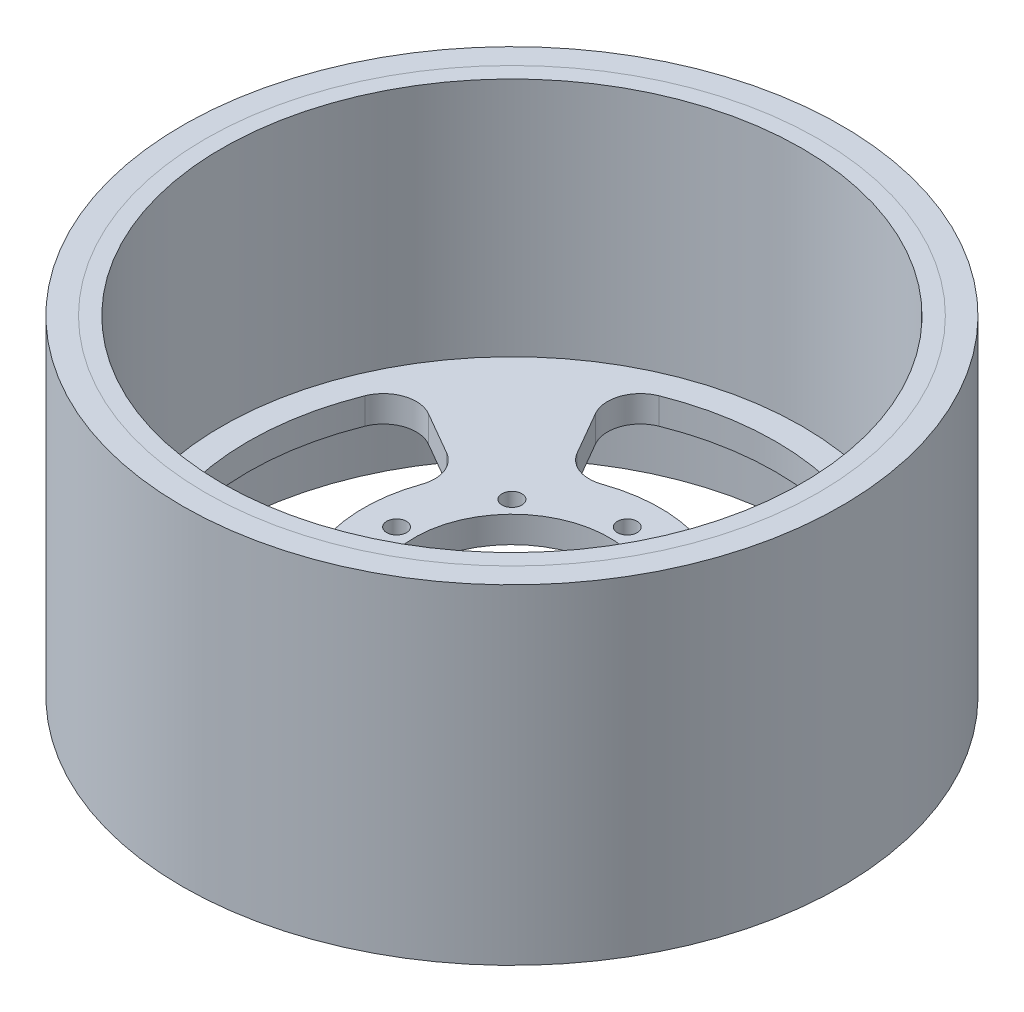
from build123d import *

# Parameters (mm, degrees)
SKETCH_1_R          = 50
EXTRUDE_1_DEPTH     = 50
SKETCH_2_R          = 44
CUT_EXTRUDE_1_DEPTH = 36.5
CUT_EXTRUDE_START   = -9.5
SKETCH_3_R          = 44
CUT_EXTRUDE_2_DEPTH = 9.5
SKETCH_4_R          = 14.75
SKETCH_4_R_2        = 1.5
CUT_EXTRUDE_3_DEPTH = 4
CUT_EXTRUDE_4_DEPTH = 4
FILLET_1_R          = 5


with BuildPart() as part:
    # 草图1 → 凸台-拉伸1 (new body)
    with BuildSketch(Plane(origin=(0, 0, 0), x_dir=(1, 0, 0), z_dir=(0, 1, 0))):
        with Locations(Location((0, 0, 0), (0, 0, 270))):
            Circle(SKETCH_1_R)
    extrude(amount=EXTRUDE_1_DEPTH)

    # 草图2 → 切除-拉伸1 (cut)
    with BuildSketch(Plane(origin=(0, 50, 0), x_dir=(1, 0, 0), z_dir=(0, 1, 0))):
        with Locations(Location((0, 0, 0), (0, 0, 270))):
            Circle(SKETCH_2_R)
    extrude(amount=-CUT_EXTRUDE_1_DEPTH, mode=Mode.SUBTRACT)

    # 草图3 → 切除-拉伸2 (cut)
    with BuildSketch(Plane.XZ.offset(CUT_EXTRUDE_START)):
        with Locations(Location((0, 0, 0), (0, 0, 90))):
            Circle(SKETCH_3_R)
    extrude(amount=CUT_EXTRUDE_2_DEPTH, mode=Mode.SUBTRACT)

    # 草图4 → 切除-拉伸3 (cut)
    with BuildSketch(Plane(origin=(0, 13.5, 0), x_dir=(1, 0, 0), z_dir=(0, 1, 0))):
        with Locations(Location((0, 0, 0), (0, 0, 270))):
            Circle(SKETCH_4_R)
        with Locations(Location((0, 17.5, 0), (0, 0, 270))):
            Circle(SKETCH_4_R_2)
        with Locations(Location((12.374368671, 12.374368671, 0), (0, 0, 270))):
            Circle(SKETCH_4_R_2)
        with Locations(Location((17.5, 0, 0), (0, 0, 270))):
            Circle(SKETCH_4_R_2)
        with Locations(Location((12.374368671, -12.374368671, 0), (0, 0, 270))):
            Circle(SKETCH_4_R_2)
        with Locations(Location((0, -17.5, 0), (0, 0, 270))):
            Circle(SKETCH_4_R_2)
        with Locations(Location((-12.374368671, -12.374368671, 0), (0, 0, 270))):
            Circle(SKETCH_4_R_2)
        with Locations(Location((-17.5, 0, 0), (0, 0, 270))):
            Circle(SKETCH_4_R_2)
        with Locations(Location((-12.374368671, 12.374368671, 0), (0, 0, 270))):
            Circle(SKETCH_4_R_2)
    extrude(amount=-CUT_EXTRUDE_3_DEPTH, mode=Mode.SUBTRACT)

    # 草图8 → 切除-拉伸4 (cut)
    with BuildSketch(Plane(origin=(0, 13.5, 0), x_dir=(1, 0, 0), z_dir=(0, 1, 0))):
        with BuildLine():
            Line((-11.25, 19.485571585), (-20, 34.641016151))
            ThreePointArc((-20, 34.641016151), (0, 40), (20, 34.641016151))
            Line((20, 34.641016151), (11.25, 19.485571585))
            ThreePointArc((11.25, 19.485571585), (0, 22.5), (-11.25, 19.485571585))
        make_face()
        with BuildLine():
            Line((19.485571585, 11.25), (34.641016151, 20))
            ThreePointArc((34.641016151, 20), (40, 0), (34.641016151, -20))
            Line((34.641016151, -20), (19.485571585, -11.25))
            ThreePointArc((19.485571585, -11.25), (22.5, 0), (19.485571585, 11.25))
        make_face()
        with BuildLine():
            Line((11.25, -19.485571585), (20, -34.641016151))
            ThreePointArc((20, -34.641016151), (0, -40), (-20, -34.641016151))
            Line((-20, -34.641016151), (-11.25, -19.485571585))
            ThreePointArc((-11.25, -19.485571585), (0, -22.5), (11.25, -19.485571585))
        make_face()
        with BuildLine():
            Line((-19.485571585, -11.25), (-34.641016151, -20))
            ThreePointArc((-34.641016151, -20), (-40, 0), (-34.641016151, 20))
            Line((-34.641016151, 20), (-19.485571585, 11.25))
            ThreePointArc((-19.485571585, 11.25), (-22.5, 0), (-19.485571585, -11.25))
        make_face()
    extrude(amount=-CUT_EXTRUDE_4_DEPTH, mode=Mode.SUBTRACT)

    # 圆角1
    fillet_1_edges = [part.edges().sort_by_distance(p)[0] for p in [
        (-11.25, 11.5, 19.485571585),
        (11.25, 11.5, 19.485571585),
        (20, 11.5, 34.641016151),
        (-20, 11.5, 34.641016151),
        (19.485571585, 11.5, 11.25),
        (19.485571585, 11.5, -11.25),
        (34.641016151, 11.5, -20),
        (34.641016151, 11.5, 20),
        (-19.485571585, 11.5, -11.25),
        (-19.485571585, 11.5, 11.25),
        (-34.641016151, 11.5, 20),
        (-34.641016151, 11.5, -20),
        (11.25, 11.5, -19.485571585),
        (-11.25, 11.5, -19.485571585),
        (-20, 11.5, -34.641016151),
        (20, 11.5, -34.641016151),
    ]]
    fillet(fillet_1_edges, radius=FILLET_1_R)


solid = part.part
